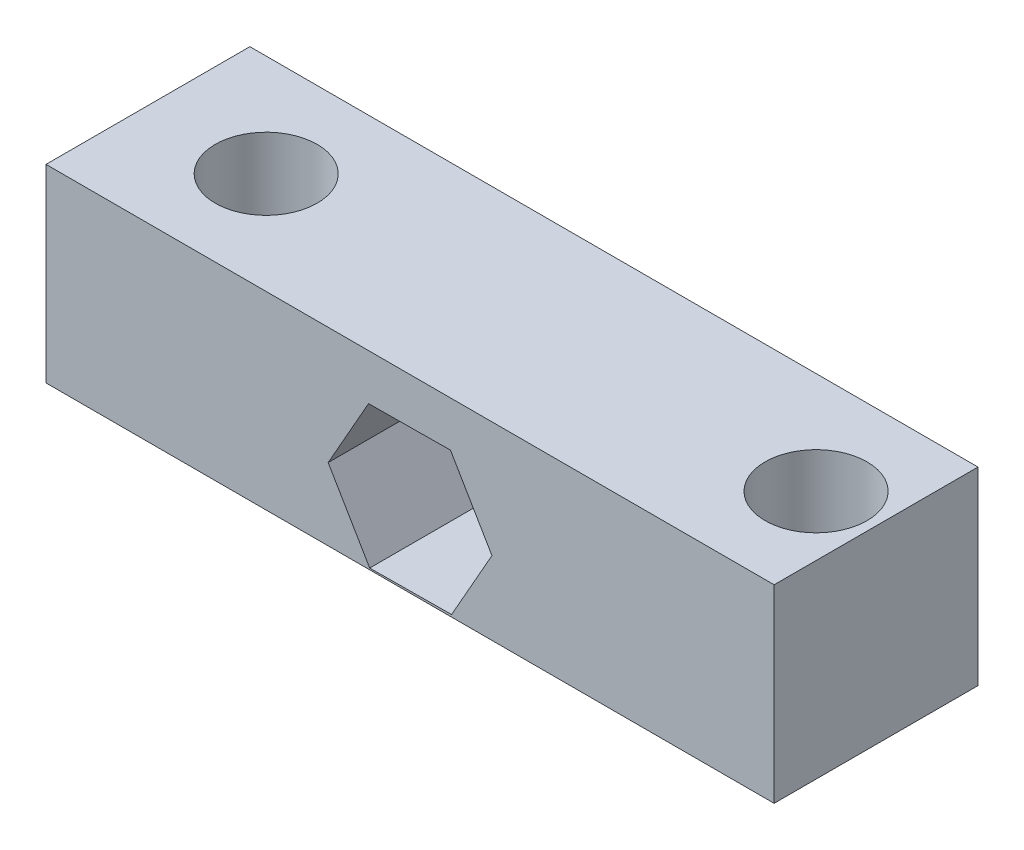
from build123d import *

# Parameters (mm, degrees)
SKETCH1_W               = 25
SKETCH1_H               = 7
SKETCH1_R               = 1.75
BOSS_EXTRUDE1_DEPTH     = 6.5
CUT_EXTRUDE1_DEPTH      = 15.517231141
CUT_EXTRUDE1_DEPTH_BACK = 15.517231141


with BuildPart() as part:
    # Sketch1 → Boss-Extrude1 (new body)
    with BuildSketch(Plane(origin=(0, 0, 0), x_dir=(1, 0, 0), z_dir=(0, 1, 0))):
        Rectangle(SKETCH1_W, SKETCH1_H)
        with Locations(Location((10.44, 0, 0), (0, 0, 90))):
            Circle(SKETCH1_R, mode=Mode.SUBTRACT)
        with Locations(Location((-8.44, 0, 0), (0, 0, 90))):
            Circle(SKETCH1_R, mode=Mode.SUBTRACT)
    extrude(amount=BOSS_EXTRUDE1_DEPTH)

    # Sketch3 → Cut-Extrude1 (cut, two sides: drawn at the far end of the back side and taken through both)
    with BuildSketch(Plane.XY.offset(-CUT_EXTRUDE1_DEPTH_BACK)):
        Polygon((1.425586366, 0.076503178), (2.811602997, 2.522845597), (1.386016631, 4.946342419), (-1.425586366, 4.923496822), (-2.811602997, 2.477154403), (-1.386016631, 0.053657581), align=None)
    extrude(amount=CUT_EXTRUDE1_DEPTH + CUT_EXTRUDE1_DEPTH_BACK, mode=Mode.SUBTRACT)


solid = part.part
